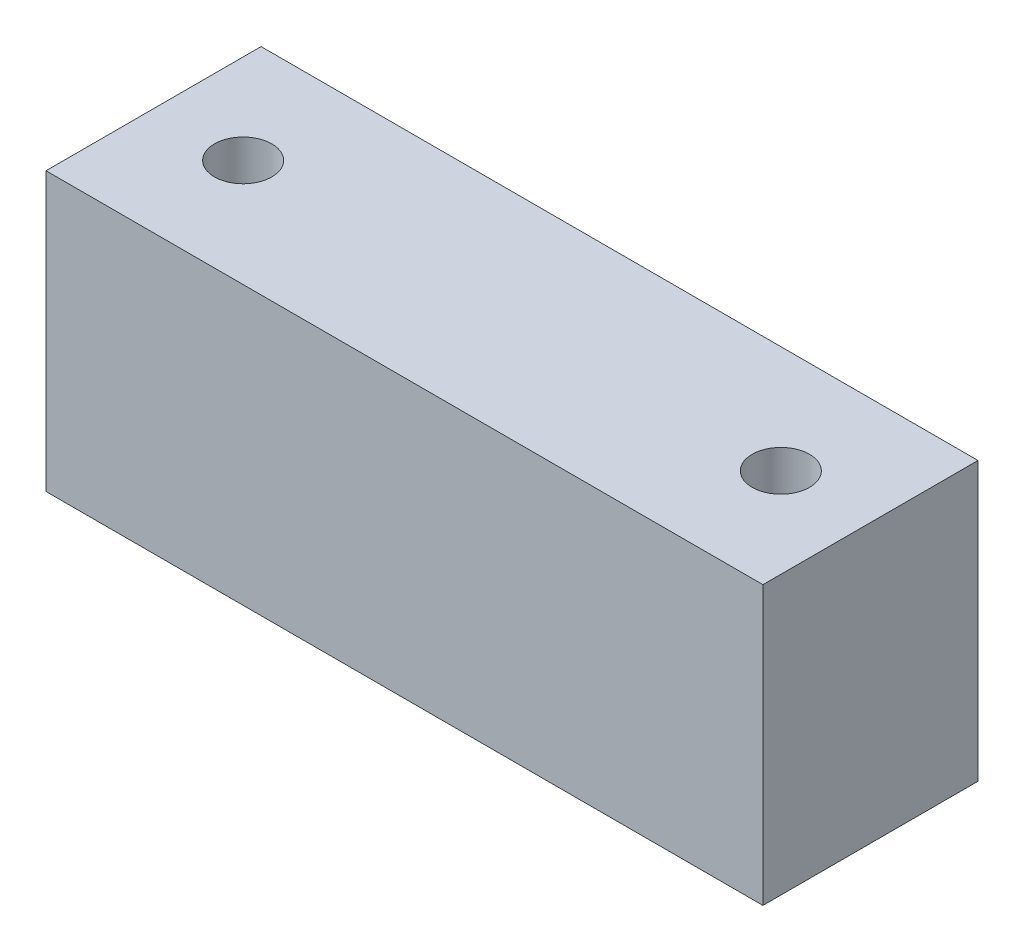
from build123d import *

# Parameters (mm, degrees)
SKETCH1_W           = 40
SKETCH1_H           = 12
BOSS_EXTRUDE1_DEPTH = 15.5
SKETCH2_R           = 1.6
CUT_EXTRUDE2_DEPTH  = 27.004807248


with BuildPart() as part:
    # Sketch1 → Boss-Extrude1 (new body)
    with BuildSketch(Plane(origin=(0, 0, 0), x_dir=(1, 0, 0), z_dir=(0, 1, 0))):
        Rectangle(SKETCH1_W, SKETCH1_H)
    extrude(amount=BOSS_EXTRUDE1_DEPTH)

    # Sketch2 → Cut-Extrude2 (cut, through all)
    with BuildSketch(Plane(origin=(0, 15.5, 0), x_dir=(1, 0, 0), z_dir=(0, 1, 0))):
        with Locations((15, 0)):
            Circle(SKETCH2_R)
        with Locations((-15, 0)):
            Circle(SKETCH2_R)
    extrude(amount=-CUT_EXTRUDE2_DEPTH, mode=Mode.SUBTRACT)


solid = part.part
